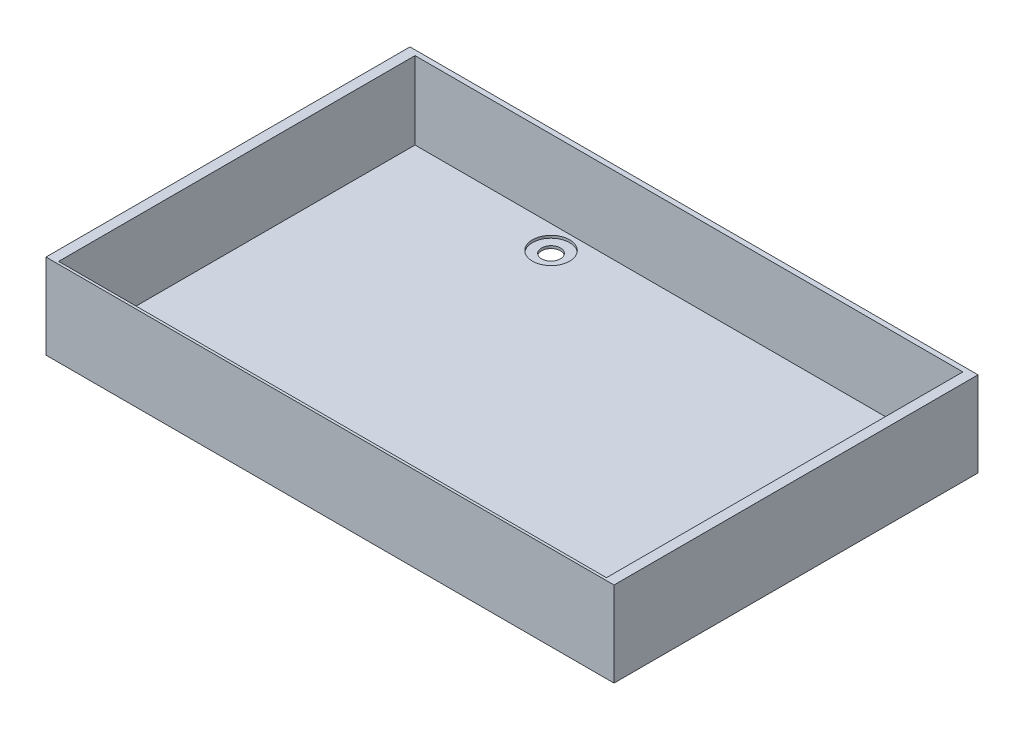
from build123d import *

# Parameters (mm, degrees)
SKIZZE1_W                       = 90.2
SKIZZE1_H                       = 57.8
SKIZZE1_W_2                     = 87
SKIZZE1_H_2                     = 56.6
AUFSATZ_LINEAR_AUSTRAGEN1_DEPTH = 12.3
SKIZZE2_W                       = 90.2
SKIZZE2_H                       = 57.8
AUFSATZ_LINEAR_AUSTRAGEN2_DEPTH = 1.2
SKIZZE3_R                       = 1.5
SCHNITT_LINEAR_AUSTRAGEN1_DEPTH = 1.2
SKIZZE4_R                       = 2.45
SCHNITT_LINEAR_AUSTRAGEN2_DEPTH = 0.4
SKIZZE5_R                       = 2.95
SCHNITT_LINEAR_AUSTRAGEN3_DEPTH = 0.4


with BuildPart() as part:
    # Skizze1 → Aufsatz-Linear austragen1 (new body)
    with BuildSketch(Plane(origin=(0, 0, 0), x_dir=(1, 0, 0), z_dir=(0, 1, 0))):
        with Locations((45.1, 28.9)):
            Rectangle(SKIZZE1_W, SKIZZE1_H)
        with Locations((45.1, 28.7)):
            Rectangle(SKIZZE1_W_2, SKIZZE1_H_2, mode=Mode.SUBTRACT)
    extrude(amount=AUFSATZ_LINEAR_AUSTRAGEN1_DEPTH)

    # Skizze2 → Aufsatz-Linear austragen2 (add)
    with BuildSketch(Plane(origin=(0, 0, 0), x_dir=(1, 0, 0), z_dir=(0, 1, 0))):
        with Locations((45.1, 28.9)):
            Rectangle(SKIZZE2_W, SKIZZE2_H)
    extrude(amount=-AUFSATZ_LINEAR_AUSTRAGEN2_DEPTH)

    # Skizze3 → Schnitt-Linear austragen1 (cut)
    with BuildSketch(Plane(origin=(0, 0, 0), x_dir=(1, 0, 0), z_dir=(0, 1, 0))):
        with Locations(Location((84.9, 53.3, 0), (0, 0, 270))):
            Circle(SKIZZE3_R)
        with Locations(Location((26.9, 53.3, 0), (0, 0, 270))):
            Circle(SKIZZE3_R)
        with Locations(Location((84.9, 4.3, 0), (0, 0, 270))):
            Circle(SKIZZE3_R)
        with Locations(Location((26.9, 4.3, 0), (0, 0, 270))):
            Circle(SKIZZE3_R)
    extrude(amount=-SCHNITT_LINEAR_AUSTRAGEN1_DEPTH, mode=Mode.SUBTRACT)

    # Skizze4 → Schnitt-Linear austragen2 (cut)
    with BuildSketch(Plane(origin=(0, -1.2, 0), x_dir=(1, 0, 0), z_dir=(0, 1, 0))):
        with Locations(Location((84.9, 53.3, 0), (0, 0, 270))):
            Circle(SKIZZE4_R)
        with Locations(Location((26.9, 53.3, 0), (0, 0, 270))):
            Circle(SKIZZE4_R)
        with Locations(Location((84.9, 4.3, 0), (0, 0, 270))):
            Circle(SKIZZE4_R)
        with Locations(Location((26.9, 4.3, 0), (0, 0, 270))):
            Circle(SKIZZE4_R)
    extrude(amount=SCHNITT_LINEAR_AUSTRAGEN2_DEPTH, mode=Mode.SUBTRACT)

    # Skizze5 → Schnitt-Linear austragen3 (cut)
    with BuildSketch(Plane(origin=(0, 0, 0), x_dir=(1, 0, 0), z_dir=(0, 1, 0))):
        with Locations(Location((84.9, 53.3, 0), (0, 0, 270))):
            Circle(SKIZZE5_R)
        with Locations(Location((26.9, 53.3, 0), (0, 0, 270))):
            Circle(SKIZZE5_R)
        with Locations(Location((84.9, 4.3, 0), (0, 0, 270))):
            Circle(SKIZZE5_R)
        with Locations(Location((26.9, 4.3, 0), (0, 0, 270))):
            Circle(SKIZZE5_R)
    extrude(amount=-SCHNITT_LINEAR_AUSTRAGEN3_DEPTH, mode=Mode.SUBTRACT)


solid = part.part
